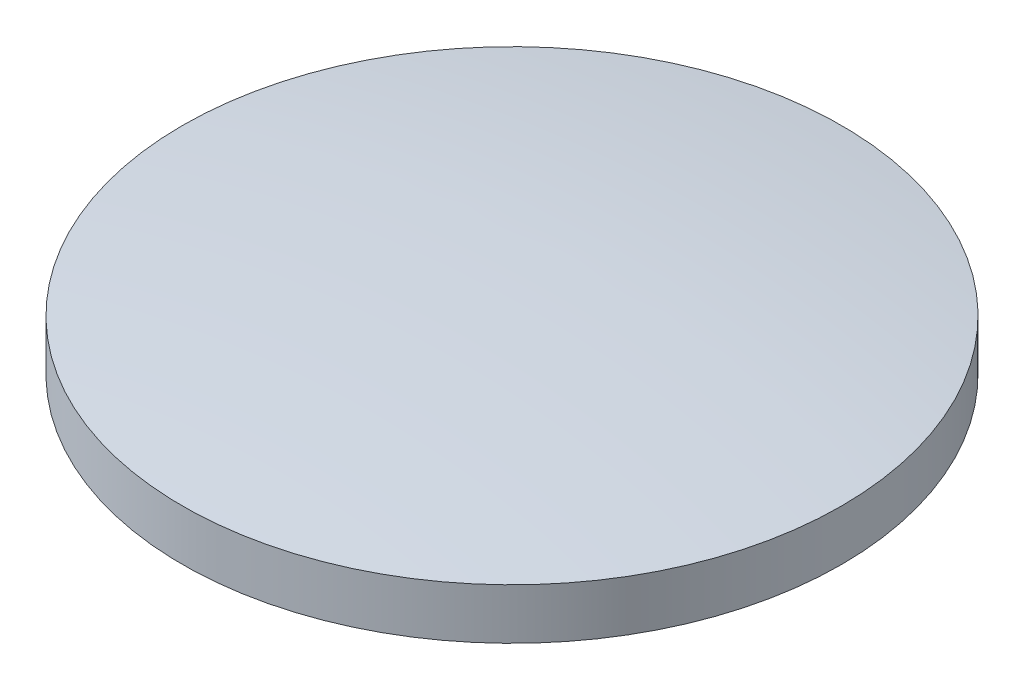
from build123d import *


with BuildPart() as part:
    # Sketch1 → Revolve1 (revolve)
    with BuildSketch(Plane.XY):
        with BuildLine():
            Line((45.5, -5.752625516), (45.5, -12.752625516))
            Line((45.5, -12.752625516), (0, -12.752625516))
            Line((0, -12.752625516), (0, -2.62))
            ThreePointArc((0, -2.62), (22.803855719, -3.40408226), (45.5, -5.752625516))
        make_face()
    revolve(axis=Axis((0, -12.752625516, 0), (0, 1, 0)))


solid = part.part
